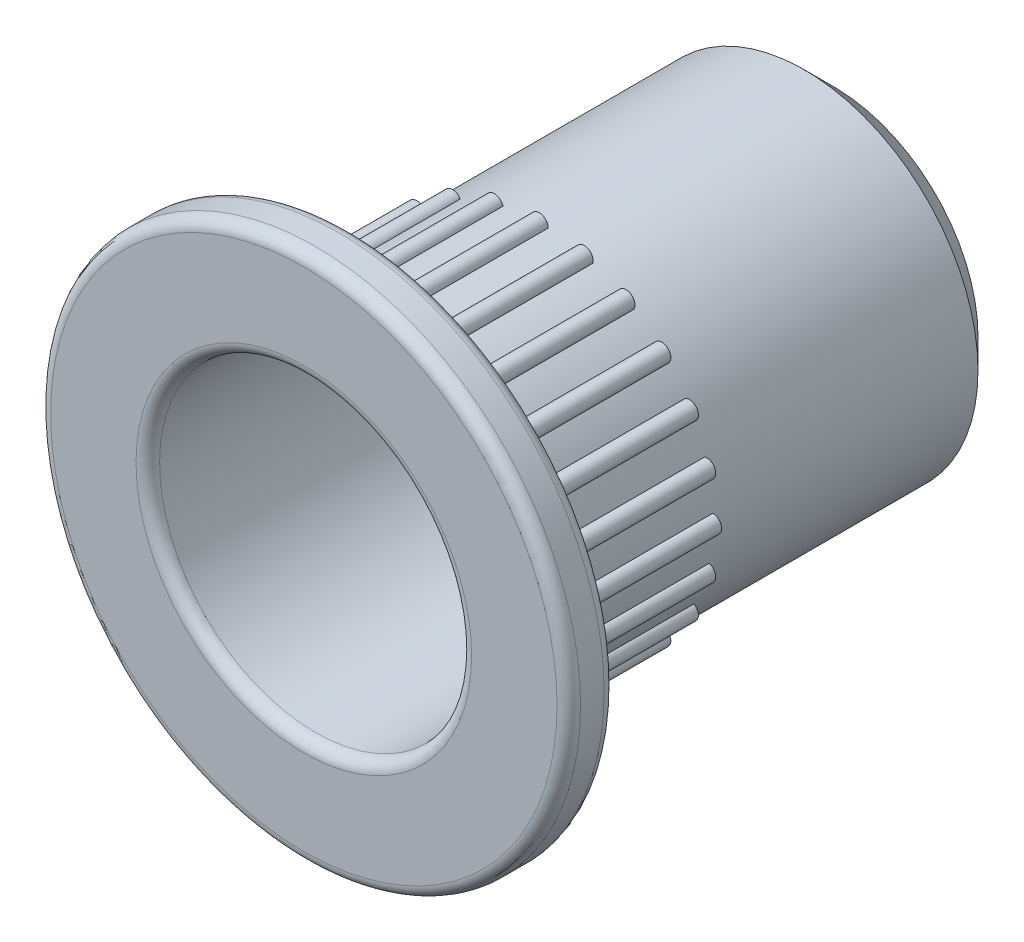
from build123d import *

# Parameters (mm, degrees)
SKETCH_1_R               = 2.95
EXTRUDE_1_DEPTH          = 9
SKETCH_2_R               = 4.5
SKETCH_2_R_2             = 2.6
EXTRUDE_2_DEPTH          = 0.8
SKETCH_3_R               = 2
CUT_EXTRUDE_1_DEPTH      = 12.022703843
EXTRUDE_3_REACH          = 10.093
PATTERN_CIRCULAR_1_COUNT = 24
CHAMFER_2_SIZE           = 0.5
FILLET_1_R               = 0.2
SKETCH_6_R               = 2.65
SKETCH_6_R_2             = 2
CUT_EXTRUDE_2_DEPTH      = 4
FILLET_2_R               = 0.2


with BuildPart() as part:
    # Эскиз1 → Вытянуть1 (new body)
    with BuildSketch(Plane.XY):
        Circle(SKETCH_1_R)
    extrude(amount=EXTRUDE_1_DEPTH)

    # Эскиз2 → Вытянуть2 (add)
    with BuildSketch(Plane.XY.offset(9)):
        Circle(SKETCH_2_R)
        Circle(SKETCH_2_R_2, mode=Mode.SUBTRACT)
    extrude(amount=-EXTRUDE_2_DEPTH)

    # Эскиз3 → Вырез-Вытянуть1 (cut, through all)
    with BuildSketch(Plane.XY.offset(9)):
        Circle(SKETCH_3_R)
    extrude(amount=-CUT_EXTRUDE_1_DEPTH, mode=Mode.SUBTRACT)

    # Эскиз4 → Вытянуть3 (add, up to next)
    with BuildSketch(Plane.XY.offset(5), mode=Mode.PRIVATE) as extrude_3_sk1:
        with BuildLine():
            Line((0.15, 2.946183973), (-0.15, 2.946183973))
            ThreePointArc((-0.15, 2.946183973), (0, 3.096183973), (0.15, 2.946183973))
        make_face()
    extrude_3_tool1 = extrude(extrude_3_sk1.sketch, amount=EXTRUDE_3_REACH, mode=Mode.PRIVATE) - part.part
    extrude_3 = extrude_3_tool1.solids().sort_by_distance((0, 3.009846, 5))[0]
    add(extrude_3)

    # Круговой массив1: Вытянуть3 ×24 about axis
    pattern_circular_1_axis = Axis((0, 0, 0), (0, 0, 1))
    for i in range(1, PATTERN_CIRCULAR_1_COUNT):
        add(extrude_3.rotate(pattern_circular_1_axis, i * 360 / PATTERN_CIRCULAR_1_COUNT))

    # Фаска2
    chamfer_2_edges = [part.edges().sort_by_distance(p)[0] for p in [
        (-2.95, 0, 0),
    ]]
    chamfer(chamfer_2_edges, length=CHAMFER_2_SIZE)

    # Скругление1
    fillet_1_edges = [part.edges().sort_by_distance(p)[0] for p in [
        (-4.5, 0, 9),
        (-4.5, 0, 8.2),
    ]]
    fillet(fillet_1_edges, radius=FILLET_1_R)

    # Эскиз6 → Вырез-Вытянуть2 (cut)
    with BuildSketch(Plane.XY.offset(9)):
        Circle(SKETCH_6_R)
        Circle(SKETCH_6_R_2, mode=Mode.SUBTRACT)
    extrude(amount=-CUT_EXTRUDE_2_DEPTH, mode=Mode.SUBTRACT)

    # Скругление2
    fillet_2_edges = [part.edges().sort_by_distance(p)[0] for p in [
        (-2.65, 0, 9),
    ]]
    fillet(fillet_2_edges, radius=FILLET_2_R)


solid = part.part
